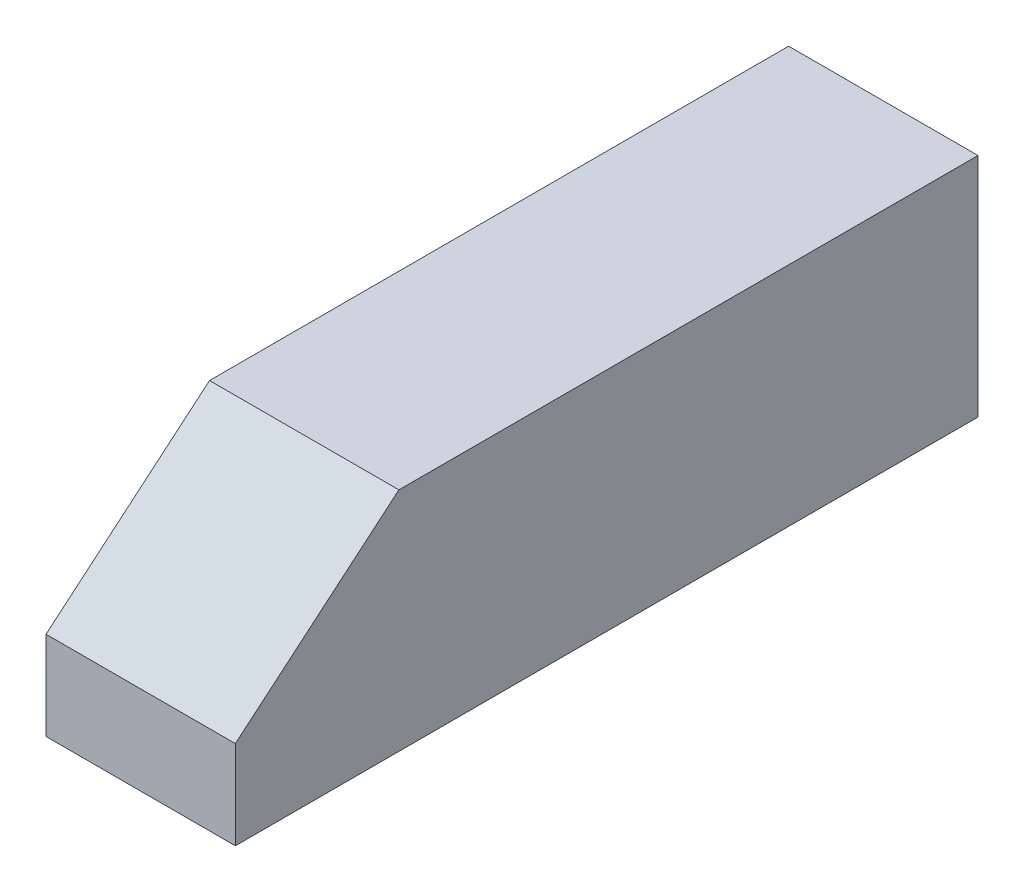
from build123d import *

# Parameters (mm, degrees)
SKETCH1_W           = 10.2
SKETCH1_H           = 12.2
BOSS_EXTRUDE1_DEPTH = 40
CUT_EXTRUDE1_DEPTH  = 50


with BuildPart() as part:
    # Sketch1 → Boss-Extrude1 (new body)
    with BuildSketch(Plane.XY):
        with Locations((-4.23559322, 0.901694915)):
            Rectangle(SKETCH1_W, SKETCH1_H)
    extrude(amount=BOSS_EXTRUDE1_DEPTH)

    # Sketch2 → Cut-Extrude1 (cut)
    with BuildSketch(Plane(origin=(0.86440678, 0, 0), x_dir=(0, 0, -1), z_dir=(1, 0, 0))):
        Polygon((-40, -0.429227244), (-31.191966643, 7.001694915), (-40, 7.001694915), align=None)
    extrude(amount=-CUT_EXTRUDE1_DEPTH, mode=Mode.SUBTRACT)


solid = part.part
